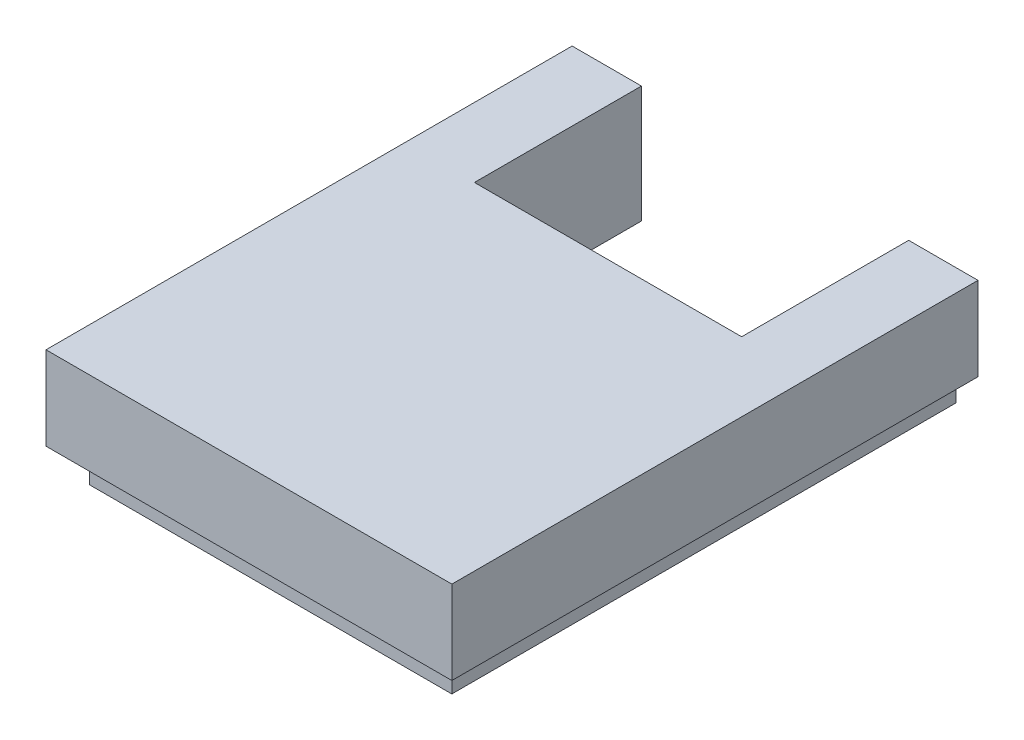
from build123d import *

# Parameters (mm, degrees)
BOSS_EXTRUDE1_DEPTH = 177.8
CUT_EXTRUDE1_DEPTH  = 50.8


with BuildPart() as part:
    # Sketch1 → Boss-Extrude1 (new body)
    with BuildSketch(Plane(origin=(0, 0, 0), x_dir=(1, 0, 0), z_dir=(0, 1, 0))):
        Polygon((308.61, 400.05), (203.2, 400.05), (203.2, 146.05), (-203.2, 146.05), (-203.2, 400.05), (-308.61, 400.05), (-308.61, -400.05), (308.61, -400.05), align=None)
    extrude(amount=BOSS_EXTRUDE1_DEPTH)

    # Sketch2 → Cut-Extrude1 (cut)
    with BuildSketch(Plane.XZ):
        Polygon((308.61, -400.05), (275.513805506, -400.05), (275.513805506, 367.013597839), (-275.682759314, 367.013597839), (-275.682759314, -400.05), (-308.61, -400.05), (-308.61, 400.05), (-275.682759314, 400.05), (275.513805506, 400.05), (308.61, 400.05), align=None)
    extrude(amount=-CUT_EXTRUDE1_DEPTH, mode=Mode.SUBTRACT)


solid = part.part
